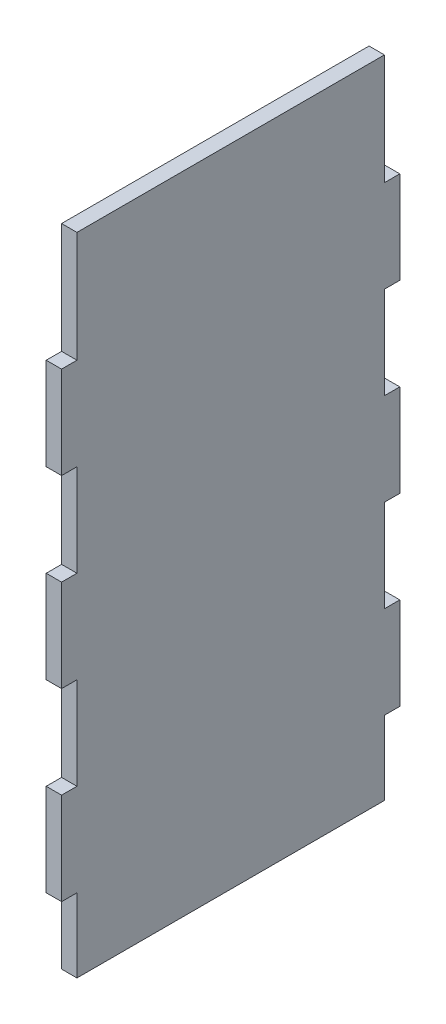
from build123d import *

# Parameters (mm, degrees)
BOSS_EXTRUDE1_DEPTH = 3.175


with BuildPart() as part:
    # Sketch1 → Boss-Extrude1 (new body)
    with BuildSketch(Plane(origin=(0, 0, 0), x_dir=(0, 0, -1), z_dir=(1, 0, 0))):
        Polygon((0, 110.49), (3.175, 110.49), (3.175, 91.44), (0, 91.44), (0, 72.39), (3.175, 72.39), (3.175, 53.34), (0, 53.34), (0, 34.29), (3.175, 34.29), (3.175, 15.24), (0, 15.24), (0, 0), (-63.5, 0), (-63.5, 15.24), (-66.675, 15.24), (-66.675, 34.29), (-63.5, 34.29), (-63.5, 53.34), (-66.675, 53.34), (-66.675, 72.39), (-63.5, 72.39), (-63.5, 91.44), (-66.675, 91.44), (-66.675, 110.49), (-63.5, 110.49), (-63.5, 133.35), (0, 133.35), align=None)
    extrude(amount=BOSS_EXTRUDE1_DEPTH)


solid = part.part
